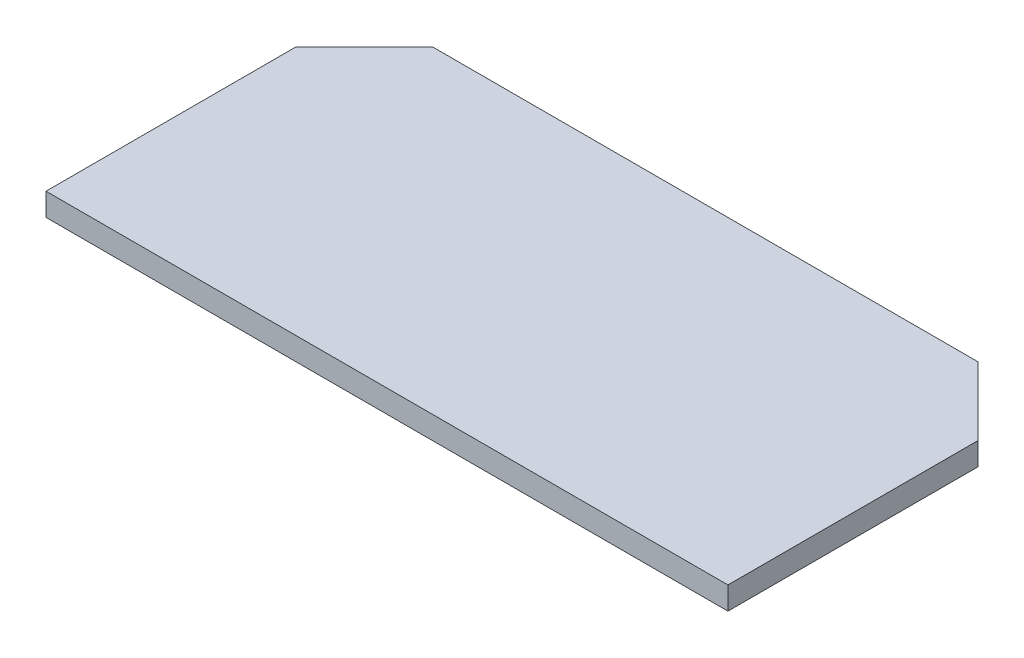
from build123d import *

# Parameters (mm, degrees)
BASE_EXTRUDE_DEPTH = 6.35


with BuildPart() as part:
    # Sketch2 → Base-Extrude (new body)
    with BuildSketch(Plane(origin=(0, 0, 0), x_dir=(1, 0, 0), z_dir=(0, 1, 0))):
        Polygon((-95.25, -19.05), (-76.2, 0), (76.2, 0), (95.25, -19.05), (95.25, -88.9), (-95.25, -88.9), align=None)
    extrude(amount=-BASE_EXTRUDE_DEPTH)


solid = part.part
